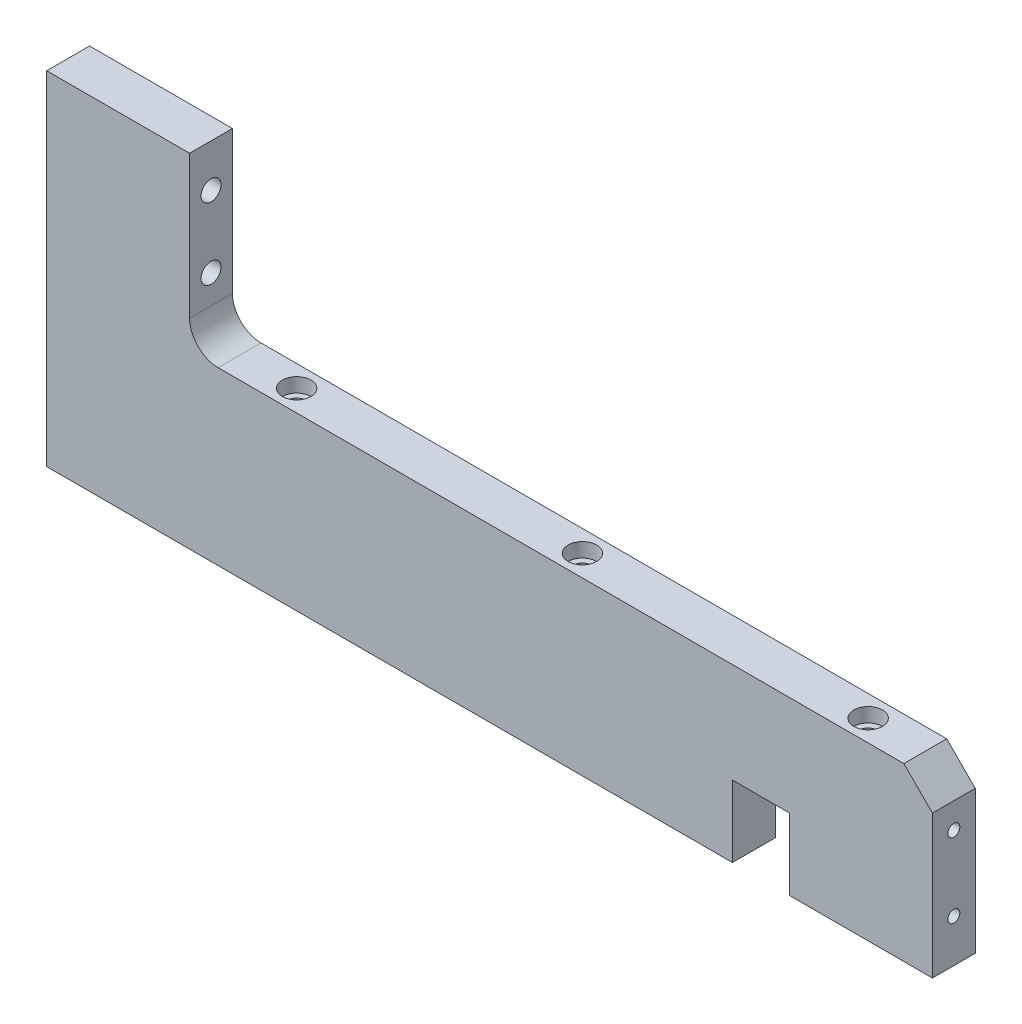
from build123d import *

# Parameters (mm, degrees)
SKETCH_1_W                   = 310
SKETCH_1_H                   = 120
EXTRUDE_1_DEPTH              = 15
SKETCH_2_W                   = 260
SKETCH_2_H                   = 60
CUT_EXTRUDE_1_DEPTH          = 333.753662639
HOLE_WIZARD_M5_1_D           = 5.8
HOLE_WIZARD_M5_1_CBORE_D     = 10
HOLE_WIZARD_M5_1_CBORE_DEPTH = 5
SKETCH_7_R                   = 3.5
CUT_EXTRUDE_2_DEPTH          = 287.749019179
CHAMFER_1_SIZE               = 10
FILLET_1_R                   = 10
HOLE_WIZARD_M5_1_2_D         = 4.2
HOLE_WIZARD_M5_1_2_DEPTH     = 12.4
HOLE_WIZARD_M5_1_2_TIP       = 1.2618073
SKETCH_10_W                  = 20
SKETCH_10_H                  = 25
CUT_EXTRUDE_3_DEPTH          = 333.753662639


with BuildPart() as part:
    # 草图1 → 凸台-拉伸1 (new body)
    with BuildSketch(Plane.XY):
        with Locations((155, 60)):
            Rectangle(SKETCH_1_W, SKETCH_1_H)
    extrude(amount=EXTRUDE_1_DEPTH)

    # 草图2 → 切除-拉伸1 (cut, through all)
    with BuildSketch(Plane.XY.offset(15)):
        with Locations((180, 90)):
            Rectangle(SKETCH_2_W, SKETCH_2_H)
    extrude(amount=-CUT_EXTRUDE_1_DEPTH, mode=Mode.SUBTRACT)

    # Hole Wizard M5 _1 (through all)
    with Locations(Plane(origin=(0, 60, 0), x_dir=(-1, 0, 0), z_dir=(0, 1, 0))):
        with Locations((-80, 7.5), (-280, 7.5), (-180, 7.5)):
            CounterBoreHole(HOLE_WIZARD_M5_1_D / 2, HOLE_WIZARD_M5_1_CBORE_D / 2, HOLE_WIZARD_M5_1_CBORE_DEPTH)

    # 草图7 → 切除-拉伸2 (cut, through all)
    with BuildSketch(Plane(origin=(50, 0, 0), x_dir=(0, 0, -1), z_dir=(1, 0, 0))):
        with Locations((-7.5, 80)):
            Circle(SKETCH_7_R)
        with Locations((-7.5, 105)):
            Circle(SKETCH_7_R)
    extrude(amount=-CUT_EXTRUDE_2_DEPTH, mode=Mode.SUBTRACT)

    # 倒角1
    chamfer_1_edges = [part.edges().sort_by_distance(p)[0] for p in [
        (310, 60, 7.5),
    ]]
    chamfer(chamfer_1_edges, length=CHAMFER_1_SIZE)

    # 圆角1
    fillet_1_edges = [part.edges().sort_by_distance(p)[0] for p in [
        (50, 60, 7.5),
    ]]
    fillet(fillet_1_edges, radius=FILLET_1_R)

    # Hole Wizard M5 _1 2
    with Locations(Plane(origin=(310, 0, 0), x_dir=(0, 0, -1), z_dir=(1, 0, 0))):
        with Locations((-7.5, 41), (-7.5, 15)):
            Hole(HOLE_WIZARD_M5_1_2_D / 2, depth=HOLE_WIZARD_M5_1_2_DEPTH)
            with Locations((0, 0, -(HOLE_WIZARD_M5_1_2_DEPTH + HOLE_WIZARD_M5_1_2_TIP / 2))):  # 118° drill point
                Cone(0, HOLE_WIZARD_M5_1_2_D / 2, HOLE_WIZARD_M5_1_2_TIP, mode=Mode.SUBTRACT)

    # 草图10 → 切除-拉伸3 (cut, through all)
    with BuildSketch(Plane.XY.offset(15)):
        with Locations((250, 12.5)):
            Rectangle(SKETCH_10_W, SKETCH_10_H)
    extrude(amount=-CUT_EXTRUDE_3_DEPTH, mode=Mode.SUBTRACT)


solid = part.part
